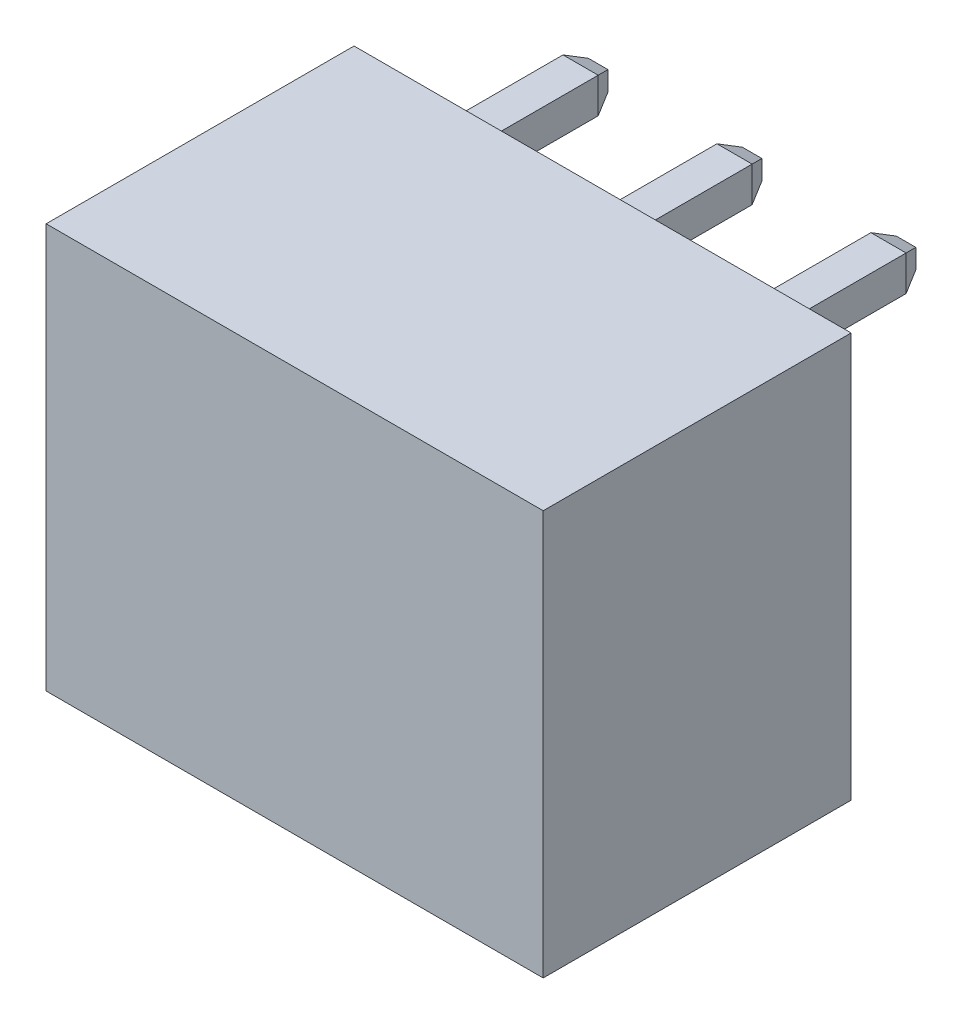
from build123d import *
from OCP.BRepFilletAPI import BRepFilletAPI_MakeChamfer

# Parameters (mm, degrees)
SKETCH_1_W                          = 11.3
SKETCH_1_H                          = 9.2
EXTRUDE_1_DEPTH                     = 7
SKETCH_2_W                          = 0.8
SKETCH_2_H                          = 0.8
EXTRUDE_2_DEPTH                     = 3.4
CHAMFER_1_SIZE                      = 0.4
CHAMFER_1_SIZE2                     = 0.178091474
CUT_EXTRUDE_1_DEPTH                 = 7
PATTERN_LINEAR_1_COUNT              = 3
PATTERN_LINEAR_1_PITCH              = 3.5
CHAMFER_1_OF_PATTERN_LINEAR_1_SIZE  = 0.4
CHAMFER_1_OF_PATTERN_LINEAR_1_SIZE2 = 0.178091474
PATTERN_LINEAR_2_COUNT              = 3
PATTERN_LINEAR_2_PITCH              = 3.5
SKETCH_4_W                          = 0.8
SKETCH_4_H                          = 0.8
EXTRUDE_3_DEPTH                     = 6
CHAMFER_2_SIZE                      = 0.4
CHAMFER_2_SIZE2                     = 0.178091474
PATTERN_LINEAR_3_COUNT              = 3
PATTERN_LINEAR_3_PITCH              = 3.5
CHAMFER_2_OF_PATTERN_LINEAR_3_SIZE  = 0.4
CHAMFER_2_OF_PATTERN_LINEAR_3_SIZE2 = 0.178091474


with BuildPart() as part:
    # Эскиз1 → Бобышка-Вытянуть1 (new body)
    with BuildSketch(Plane.XY):
        with Locations((0, 4.6)):
            Rectangle(SKETCH_1_W, SKETCH_1_H)
    extrude(amount=EXTRUDE_1_DEPTH)

    # Эскиз2 → Бобышка-Вытянуть2 (add)
    with BuildSketch(Plane(origin=(0, 0, 0), x_dir=(-1, 0, 0), z_dir=(0, 0, -1))):
        with Locations((-3.5, 8)):
            Rectangle(SKETCH_2_W, SKETCH_2_H)
    extrude_2 = extrude(amount=EXTRUDE_2_DEPTH)

    # Фаска1: one chamfer whose edges measure the first distance from different faces: ONE call of the kernel's chamfer builder (chamfer() names one face for all edges)
    chamfer_1_edges_1 = [part.edges().sort_by_distance(p)[0] for p in [
        (3.1, 8, -3.4),
    ]]
    chamfer_1_side_1 = [part.faces().sort_by_distance(p)[0] for p in [
        (3.1, 8, -1.7),
    ]]
    chamfer_1_edges_2 = [part.edges().sort_by_distance(p)[0] for p in [
        (3.5, 8.4, -3.4),
    ]]
    chamfer_1_side_2 = [part.faces().sort_by_distance(p)[0] for p in [
        (3.5, 8.4, -1.7),
    ]]
    chamfer_1_edges_3 = [part.edges().sort_by_distance(p)[0] for p in [
        (3.9, 8, -3.4),
    ]]
    chamfer_1_side_3 = [part.faces().sort_by_distance(p)[0] for p in [
        (3.9, 8, -1.7),
    ]]
    chamfer_1_edges_4 = [part.edges().sort_by_distance(p)[0] for p in [
        (3.5, 7.6, -3.4),
    ]]
    chamfer_1_side_4 = [part.faces().sort_by_distance(p)[0] for p in [
        (3.5, 7.6, -1.7),
    ]]
    chamfer_1 = BRepFilletAPI_MakeChamfer(part.part.solid().wrapped)
    for e in chamfer_1_edges_1:
        chamfer_1.Add(CHAMFER_1_SIZE, CHAMFER_1_SIZE2, e.wrapped, chamfer_1_side_1[0].wrapped)  # the first distance lies on this face
    for e in chamfer_1_edges_2:
        chamfer_1.Add(CHAMFER_1_SIZE, CHAMFER_1_SIZE2, e.wrapped, chamfer_1_side_2[0].wrapped)  # the first distance lies on this face
    for e in chamfer_1_edges_3:
        chamfer_1.Add(CHAMFER_1_SIZE, CHAMFER_1_SIZE2, e.wrapped, chamfer_1_side_3[0].wrapped)  # the first distance lies on this face
    for e in chamfer_1_edges_4:
        chamfer_1.Add(CHAMFER_1_SIZE, CHAMFER_1_SIZE2, e.wrapped, chamfer_1_side_4[0].wrapped)  # the first distance lies on this face
    add(Compound.cast(chamfer_1.Shape()), mode=Mode.REPLACE)

    # Эскиз3 → Вырез-Вытянуть1 (cut)
    with BuildSketch(Plane.XZ):
        Polygon((1.9, 0.8), (5, 0.8), (5, 5), (4, 5), (5, 6.5), (1.9, 6.5), (2.9, 5), (1.9, 5), align=None)
    cut_extrude_1 = extrude(amount=-CUT_EXTRUDE_1_DEPTH, mode=Mode.SUBTRACT)

    # Линейный массив1: Бобышка-Вытянуть2 ×3
    with Locations(*[(-i * PATTERN_LINEAR_1_PITCH, 0, 0) for i in range(1, PATTERN_LINEAR_1_COUNT)]):
        add(extrude_2)

    # Фаска1 of Линейный массив1: one chamfer whose edges measure the first distance from different faces: ONE call of the kernel's chamfer builder (chamfer() names one face for all edges)
    chamfer_1_of_pattern_linear_1_edges_1 = [part.edges().sort_by_distance(p)[0] for p in [
        (-0.4, 8, -3.4),
    ]]
    chamfer_1_of_pattern_linear_1_side_1 = [part.faces().sort_by_distance(p)[0] for p in [
        (-0.4, 8, -1.7),
    ]]
    chamfer_1_of_pattern_linear_1_edges_2 = [part.edges().sort_by_distance(p)[0] for p in [
        (0, 8.4, -3.4),
    ]]
    chamfer_1_of_pattern_linear_1_side_2 = [part.faces().sort_by_distance(p)[0] for p in [
        (0, 8.4, -1.7),
    ]]
    chamfer_1_of_pattern_linear_1_edges_3 = [part.edges().sort_by_distance(p)[0] for p in [
        (0.4, 8, -3.4),
    ]]
    chamfer_1_of_pattern_linear_1_side_3 = [part.faces().sort_by_distance(p)[0] for p in [
        (0.4, 8, -1.7),
    ]]
    chamfer_1_of_pattern_linear_1_edges_4 = [part.edges().sort_by_distance(p)[0] for p in [
        (0, 7.6, -3.4),
    ]]
    chamfer_1_of_pattern_linear_1_side_4 = [part.faces().sort_by_distance(p)[0] for p in [
        (0, 7.6, -1.7),
    ]]
    chamfer_1_of_pattern_linear_1_edges_5 = [part.edges().sort_by_distance(p)[0] for p in [
        (-3.9, 8, -3.4),
    ]]
    chamfer_1_of_pattern_linear_1_side_5 = [part.faces().sort_by_distance(p)[0] for p in [
        (-3.9, 8, -1.7),
    ]]
    chamfer_1_of_pattern_linear_1_edges_6 = [part.edges().sort_by_distance(p)[0] for p in [
        (-3.5, 8.4, -3.4),
    ]]
    chamfer_1_of_pattern_linear_1_side_6 = [part.faces().sort_by_distance(p)[0] for p in [
        (-3.5, 8.4, -1.7),
    ]]
    chamfer_1_of_pattern_linear_1_edges_7 = [part.edges().sort_by_distance(p)[0] for p in [
        (-3.1, 8, -3.4),
    ]]
    chamfer_1_of_pattern_linear_1_side_7 = [part.faces().sort_by_distance(p)[0] for p in [
        (-3.1, 8, -1.7),
    ]]
    chamfer_1_of_pattern_linear_1_edges_8 = [part.edges().sort_by_distance(p)[0] for p in [
        (-3.5, 7.6, -3.4),
    ]]
    chamfer_1_of_pattern_linear_1_side_8 = [part.faces().sort_by_distance(p)[0] for p in [
        (-3.5, 7.6, -1.7),
    ]]
    chamfer_1_of_pattern_linear_1 = BRepFilletAPI_MakeChamfer(part.part.solid().wrapped)
    for e in chamfer_1_of_pattern_linear_1_edges_1:
        chamfer_1_of_pattern_linear_1.Add(CHAMFER_1_OF_PATTERN_LINEAR_1_SIZE, CHAMFER_1_OF_PATTERN_LINEAR_1_SIZE2, e.wrapped, chamfer_1_of_pattern_linear_1_side_1[0].wrapped)  # the first distance lies on this face
    for e in chamfer_1_of_pattern_linear_1_edges_2:
        chamfer_1_of_pattern_linear_1.Add(CHAMFER_1_OF_PATTERN_LINEAR_1_SIZE, CHAMFER_1_OF_PATTERN_LINEAR_1_SIZE2, e.wrapped, chamfer_1_of_pattern_linear_1_side_2[0].wrapped)  # the first distance lies on this face
    for e in chamfer_1_of_pattern_linear_1_edges_3:
        chamfer_1_of_pattern_linear_1.Add(CHAMFER_1_OF_PATTERN_LINEAR_1_SIZE, CHAMFER_1_OF_PATTERN_LINEAR_1_SIZE2, e.wrapped, chamfer_1_of_pattern_linear_1_side_3[0].wrapped)  # the first distance lies on this face
    for e in chamfer_1_of_pattern_linear_1_edges_4:
        chamfer_1_of_pattern_linear_1.Add(CHAMFER_1_OF_PATTERN_LINEAR_1_SIZE, CHAMFER_1_OF_PATTERN_LINEAR_1_SIZE2, e.wrapped, chamfer_1_of_pattern_linear_1_side_4[0].wrapped)  # the first distance lies on this face
    for e in chamfer_1_of_pattern_linear_1_edges_5:
        chamfer_1_of_pattern_linear_1.Add(CHAMFER_1_OF_PATTERN_LINEAR_1_SIZE, CHAMFER_1_OF_PATTERN_LINEAR_1_SIZE2, e.wrapped, chamfer_1_of_pattern_linear_1_side_5[0].wrapped)  # the first distance lies on this face
    for e in chamfer_1_of_pattern_linear_1_edges_6:
        chamfer_1_of_pattern_linear_1.Add(CHAMFER_1_OF_PATTERN_LINEAR_1_SIZE, CHAMFER_1_OF_PATTERN_LINEAR_1_SIZE2, e.wrapped, chamfer_1_of_pattern_linear_1_side_6[0].wrapped)  # the first distance lies on this face
    for e in chamfer_1_of_pattern_linear_1_edges_7:
        chamfer_1_of_pattern_linear_1.Add(CHAMFER_1_OF_PATTERN_LINEAR_1_SIZE, CHAMFER_1_OF_PATTERN_LINEAR_1_SIZE2, e.wrapped, chamfer_1_of_pattern_linear_1_side_7[0].wrapped)  # the first distance lies on this face
    for e in chamfer_1_of_pattern_linear_1_edges_8:
        chamfer_1_of_pattern_linear_1.Add(CHAMFER_1_OF_PATTERN_LINEAR_1_SIZE, CHAMFER_1_OF_PATTERN_LINEAR_1_SIZE2, e.wrapped, chamfer_1_of_pattern_linear_1_side_8[0].wrapped)  # the first distance lies on this face
    add(Compound.cast(chamfer_1_of_pattern_linear_1.Shape()), mode=Mode.REPLACE)

    # Линейный массив2: Вырез-Вытянуть1 ×3
    with Locations(*[(-i * PATTERN_LINEAR_2_PITCH, 0, 0) for i in range(1, PATTERN_LINEAR_2_COUNT)]):
        add(cut_extrude_1, mode=Mode.SUBTRACT)

    # Эскиз4 → Бобышка-Вытянуть3 (add)
    with BuildSketch(Plane.XZ.offset(-7)):
        with Locations((3.5, 3)):
            Rectangle(SKETCH_4_W, SKETCH_4_H)
    extrude_3 = extrude(amount=EXTRUDE_3_DEPTH)

    # Фаска2: one chamfer whose edges measure the first distance from different faces: ONE call of the kernel's chamfer builder (chamfer() names one face for all edges)
    chamfer_2_edges_1 = [part.edges().sort_by_distance(p)[0] for p in [
        (3.9, 1, 3),
    ]]
    chamfer_2_side_1 = [part.faces().sort_by_distance(p)[0] for p in [
        (3.9, 4, 3),
    ]]
    chamfer_2_edges_2 = [part.edges().sort_by_distance(p)[0] for p in [
        (3.5, 1, 3.4),
    ]]
    chamfer_2_side_2 = [part.faces().sort_by_distance(p)[0] for p in [
        (3.5, 4, 3.4),
    ]]
    chamfer_2_edges_3 = [part.edges().sort_by_distance(p)[0] for p in [
        (3.1, 1, 3),
    ]]
    chamfer_2_side_3 = [part.faces().sort_by_distance(p)[0] for p in [
        (3.1, 4, 3),
    ]]
    chamfer_2_edges_4 = [part.edges().sort_by_distance(p)[0] for p in [
        (3.5, 1, 2.6),
    ]]
    chamfer_2_side_4 = [part.faces().sort_by_distance(p)[0] for p in [
        (3.5, 4, 2.6),
    ]]
    chamfer_2 = BRepFilletAPI_MakeChamfer(part.part.solid().wrapped)
    for e in chamfer_2_edges_1:
        chamfer_2.Add(CHAMFER_2_SIZE, CHAMFER_2_SIZE2, e.wrapped, chamfer_2_side_1[0].wrapped)  # the first distance lies on this face
    for e in chamfer_2_edges_2:
        chamfer_2.Add(CHAMFER_2_SIZE, CHAMFER_2_SIZE2, e.wrapped, chamfer_2_side_2[0].wrapped)  # the first distance lies on this face
    for e in chamfer_2_edges_3:
        chamfer_2.Add(CHAMFER_2_SIZE, CHAMFER_2_SIZE2, e.wrapped, chamfer_2_side_3[0].wrapped)  # the first distance lies on this face
    for e in chamfer_2_edges_4:
        chamfer_2.Add(CHAMFER_2_SIZE, CHAMFER_2_SIZE2, e.wrapped, chamfer_2_side_4[0].wrapped)  # the first distance lies on this face
    add(Compound.cast(chamfer_2.Shape()), mode=Mode.REPLACE)

    # Линейный массив3: Бобышка-Вытянуть3 ×3
    with Locations(*[(-i * PATTERN_LINEAR_3_PITCH, 0, 0) for i in range(1, PATTERN_LINEAR_3_COUNT)]):
        add(extrude_3)

    # Фаска2 of Линейный массив3: one chamfer whose edges measure the first distance from different faces: ONE call of the kernel's chamfer builder (chamfer() names one face for all edges)
    chamfer_2_of_pattern_linear_3_edges_1 = [part.edges().sort_by_distance(p)[0] for p in [
        (0.4, 1, 3),
    ]]
    chamfer_2_of_pattern_linear_3_side_1 = [part.faces().sort_by_distance(p)[0] for p in [
        (0.4, 4, 3),
    ]]
    chamfer_2_of_pattern_linear_3_edges_2 = [part.edges().sort_by_distance(p)[0] for p in [
        (0, 1, 3.4),
    ]]
    chamfer_2_of_pattern_linear_3_side_2 = [part.faces().sort_by_distance(p)[0] for p in [
        (0, 4, 3.4),
    ]]
    chamfer_2_of_pattern_linear_3_edges_3 = [part.edges().sort_by_distance(p)[0] for p in [
        (-0.4, 1, 3),
    ]]
    chamfer_2_of_pattern_linear_3_side_3 = [part.faces().sort_by_distance(p)[0] for p in [
        (-0.4, 4, 3),
    ]]
    chamfer_2_of_pattern_linear_3_edges_4 = [part.edges().sort_by_distance(p)[0] for p in [
        (0, 1, 2.6),
    ]]
    chamfer_2_of_pattern_linear_3_side_4 = [part.faces().sort_by_distance(p)[0] for p in [
        (0, 4, 2.6),
    ]]
    chamfer_2_of_pattern_linear_3_edges_5 = [part.edges().sort_by_distance(p)[0] for p in [
        (-3.1, 1, 3),
    ]]
    chamfer_2_of_pattern_linear_3_side_5 = [part.faces().sort_by_distance(p)[0] for p in [
        (-3.1, 4, 3),
    ]]
    chamfer_2_of_pattern_linear_3_edges_6 = [part.edges().sort_by_distance(p)[0] for p in [
        (-3.5, 1, 3.4),
    ]]
    chamfer_2_of_pattern_linear_3_side_6 = [part.faces().sort_by_distance(p)[0] for p in [
        (-3.5, 4, 3.4),
    ]]
    chamfer_2_of_pattern_linear_3_edges_7 = [part.edges().sort_by_distance(p)[0] for p in [
        (-3.9, 1, 3),
    ]]
    chamfer_2_of_pattern_linear_3_side_7 = [part.faces().sort_by_distance(p)[0] for p in [
        (-3.9, 4, 3),
    ]]
    chamfer_2_of_pattern_linear_3_edges_8 = [part.edges().sort_by_distance(p)[0] for p in [
        (-3.5, 1, 2.6),
    ]]
    chamfer_2_of_pattern_linear_3_side_8 = [part.faces().sort_by_distance(p)[0] for p in [
        (-3.5, 4, 2.6),
    ]]
    chamfer_2_of_pattern_linear_3 = BRepFilletAPI_MakeChamfer(part.part.solid().wrapped)
    for e in chamfer_2_of_pattern_linear_3_edges_1:
        chamfer_2_of_pattern_linear_3.Add(CHAMFER_2_OF_PATTERN_LINEAR_3_SIZE, CHAMFER_2_OF_PATTERN_LINEAR_3_SIZE2, e.wrapped, chamfer_2_of_pattern_linear_3_side_1[0].wrapped)  # the first distance lies on this face
    for e in chamfer_2_of_pattern_linear_3_edges_2:
        chamfer_2_of_pattern_linear_3.Add(CHAMFER_2_OF_PATTERN_LINEAR_3_SIZE, CHAMFER_2_OF_PATTERN_LINEAR_3_SIZE2, e.wrapped, chamfer_2_of_pattern_linear_3_side_2[0].wrapped)  # the first distance lies on this face
    for e in chamfer_2_of_pattern_linear_3_edges_3:
        chamfer_2_of_pattern_linear_3.Add(CHAMFER_2_OF_PATTERN_LINEAR_3_SIZE, CHAMFER_2_OF_PATTERN_LINEAR_3_SIZE2, e.wrapped, chamfer_2_of_pattern_linear_3_side_3[0].wrapped)  # the first distance lies on this face
    for e in chamfer_2_of_pattern_linear_3_edges_4:
        chamfer_2_of_pattern_linear_3.Add(CHAMFER_2_OF_PATTERN_LINEAR_3_SIZE, CHAMFER_2_OF_PATTERN_LINEAR_3_SIZE2, e.wrapped, chamfer_2_of_pattern_linear_3_side_4[0].wrapped)  # the first distance lies on this face
    for e in chamfer_2_of_pattern_linear_3_edges_5:
        chamfer_2_of_pattern_linear_3.Add(CHAMFER_2_OF_PATTERN_LINEAR_3_SIZE, CHAMFER_2_OF_PATTERN_LINEAR_3_SIZE2, e.wrapped, chamfer_2_of_pattern_linear_3_side_5[0].wrapped)  # the first distance lies on this face
    for e in chamfer_2_of_pattern_linear_3_edges_6:
        chamfer_2_of_pattern_linear_3.Add(CHAMFER_2_OF_PATTERN_LINEAR_3_SIZE, CHAMFER_2_OF_PATTERN_LINEAR_3_SIZE2, e.wrapped, chamfer_2_of_pattern_linear_3_side_6[0].wrapped)  # the first distance lies on this face
    for e in chamfer_2_of_pattern_linear_3_edges_7:
        chamfer_2_of_pattern_linear_3.Add(CHAMFER_2_OF_PATTERN_LINEAR_3_SIZE, CHAMFER_2_OF_PATTERN_LINEAR_3_SIZE2, e.wrapped, chamfer_2_of_pattern_linear_3_side_7[0].wrapped)  # the first distance lies on this face
    for e in chamfer_2_of_pattern_linear_3_edges_8:
        chamfer_2_of_pattern_linear_3.Add(CHAMFER_2_OF_PATTERN_LINEAR_3_SIZE, CHAMFER_2_OF_PATTERN_LINEAR_3_SIZE2, e.wrapped, chamfer_2_of_pattern_linear_3_side_8[0].wrapped)  # the first distance lies on this face
    add(Compound.cast(chamfer_2_of_pattern_linear_3.Shape()), mode=Mode.REPLACE)


solid = part.part
